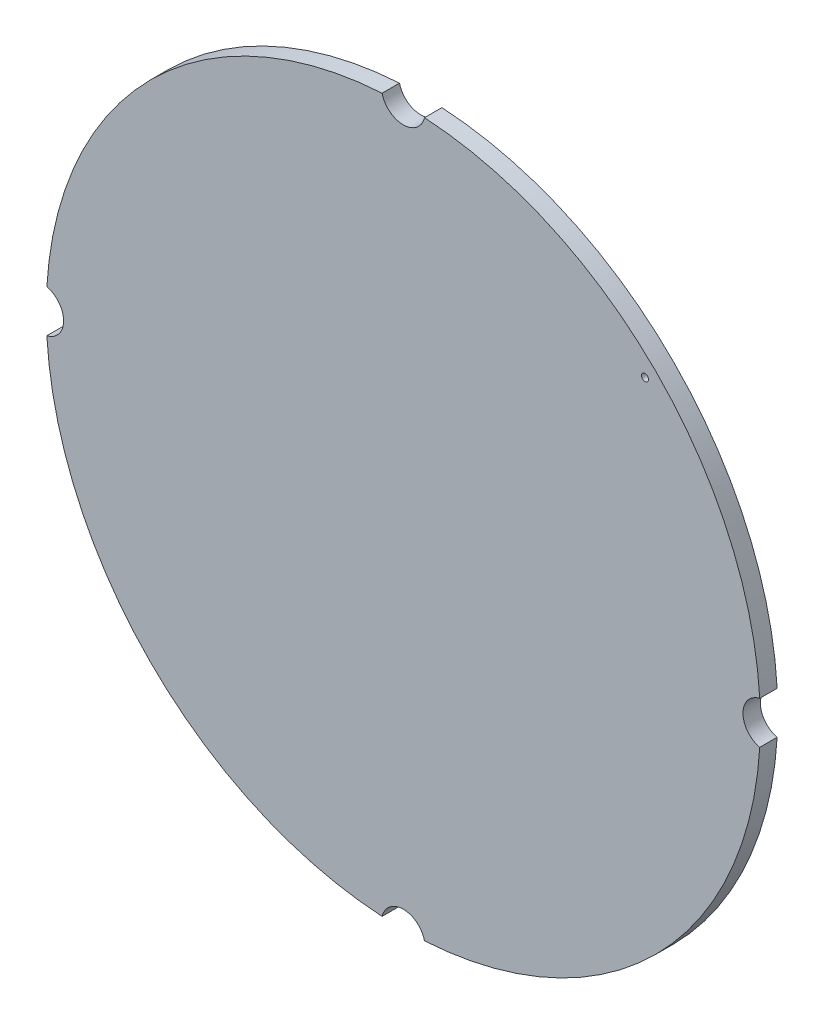
from build123d import *

# Parameters (mm, degrees)
SKETCH1_R             = 82
SKETCH1_R_2           = 75
BOSS_EXTRUDE1_DEPTH   = 3
SKETCH2_R             = 82
BOSS_EXTRUDE2_DEPTH   = 1
SKETCH4_R             = 5
CUT_EXTRUDE1_DEPTH    = 117.034477635
CIRPATTERN1_COUNT     = 4
M2X0_4_TAPPED_HOLE1_D = 1.6


with BuildPart() as part:
    # Sketch1 → Boss-Extrude1 (new body)
    with BuildSketch(Plane.XY):
        Circle(SKETCH1_R)
        Circle(SKETCH1_R_2, mode=Mode.SUBTRACT)
    extrude(amount=BOSS_EXTRUDE1_DEPTH)

    # Sketch2 → Boss-Extrude2 (add)
    with BuildSketch(Plane.XY.offset(3)):
        Circle(SKETCH2_R)
    extrude(amount=BOSS_EXTRUDE2_DEPTH)

    # Sketch4 → Cut-Extrude1 (cut, through all)
    with BuildSketch(Plane(origin=(0, 0, 0), x_dir=(-1, 0, 0), z_dir=(0, 0, -1))):
        with Locations((0, 83)):
            Circle(SKETCH4_R)
    cut_extrude1 = extrude(amount=-CUT_EXTRUDE1_DEPTH, mode=Mode.SUBTRACT)

    # CirPattern1: Cut-Extrude1 ×4 about axis
    cirpattern1_axis = Axis((0, 0, 0), (0, 0, 1))
    for i in range(1, CIRPATTERN1_COUNT):
        add(cut_extrude1.rotate(cirpattern1_axis, i * 360 / CIRPATTERN1_COUNT), mode=Mode.SUBTRACT)

    # M2x0.4 Tapped Hole1 (through all)
    with Locations(Plane.XY.offset(4)):
        with Locations((55.507882323, 55.507882323)):
            Hole(M2X0_4_TAPPED_HOLE1_D / 2)


solid = part.part
